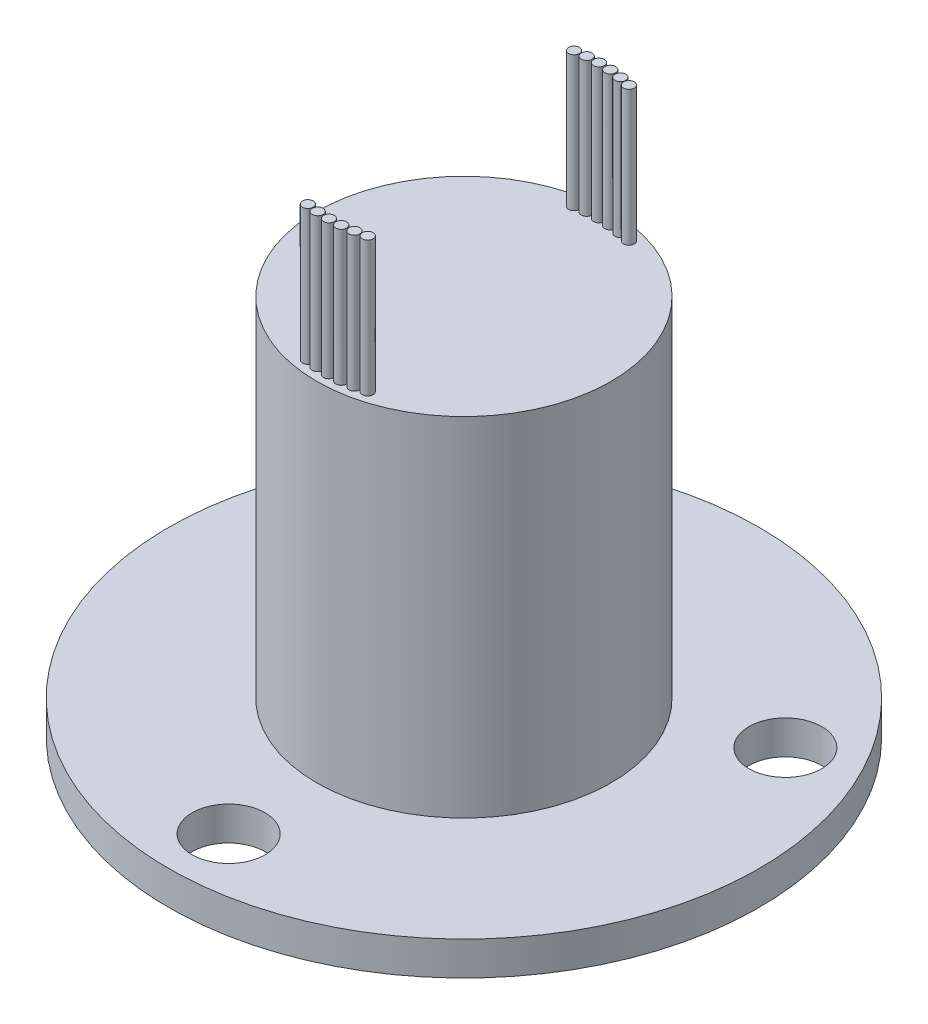
from build123d import *

# Parameters (mm, degrees)
SKETCH_1_W                  = 21.875
SKETCH_1_H                  = 2.5
SKETCH_2_R                  = 10.9
EXTRUDE_1_DEPTH             = 25.75
HOLE_WIZARD_M18_1_D         = 19.2
HOLE_WIZARD_M18_1_DEPTH     = 1.6
SKETCH_5_W                  = 8.1
SKETCH_5_H                  = 1.6
SKETCH_6_W                  = 0.4
SKETCH_6_H                  = 10
SKETCH_7_W                  = 0.4
SKETCH_7_H                  = 10
SKETCH_8_W                  = 0.4
SKETCH_8_H                  = 10
SKETCH_9_W                  = 0.4
SKETCH_9_H                  = 10
SKETCH_10_W                 = 0.4
SKETCH_10_H                 = 10
SKETCH_11_W                 = 0.4
SKETCH_11_H                 = 10
SKETCH_12_W                 = 0.4
SKETCH_12_H                 = 10
SKETCH_13_W                 = 0.4
SKETCH_13_H                 = 10
SKETCH_14_W                 = 0.4
SKETCH_14_H                 = 10
SKETCH_15_W                 = 0.4
SKETCH_15_H                 = 10
SKETCH_16_W                 = 0.4
SKETCH_16_H                 = 10
SKETCH_17_W                 = 0.4
SKETCH_17_H                 = 10
HOLE_WIZARD_5_4_5_4_1_D     = 5.4
HOLE_WIZARD_9_5_9_5_1_D     = 9.5
HOLE_WIZARD_9_5_9_5_1_DEPTH = 0.5


with BuildPart() as part:
    # 草图1 → 旋转1 (revolve)
    with BuildSketch(Plane.XY, mode=Mode.PRIVATE) as revolve_1_sk:
        with Locations((10.9375, 1.25)):
            Rectangle(SKETCH_1_W, SKETCH_1_H)
    revolve(revolve_1_sk.sketch.rotate(Axis((0, 2.5, 0), (0, -1, 0)), 270), axis=Axis((0, 2.5, 0), (0, -1, 0)))

    # 草图2 → 凸台-拉伸1 (add)
    with BuildSketch(Plane(origin=(0, 2.5, 0), x_dir=(-1, 0, 0), z_dir=(0, 1, 0))):
        with Locations(Location((0, 0, 0), (0, 0, 90))):
            Circle(SKETCH_2_R)
    extrude(amount=EXTRUDE_1_DEPTH)

    # M18 间隙孔1
    with Locations(Plane(origin=(0, 0, 0), x_dir=(-1, 0, 0), z_dir=(0, -1, 0))):
        with Locations((0, 0)):
            Hole(HOLE_WIZARD_M18_1_D / 2, depth=HOLE_WIZARD_M18_1_DEPTH)

    # 草图5 → 旋转2 (revolve)
    with BuildSketch(Plane.XY, mode=Mode.PRIVATE) as revolve_2_sk:
        with Locations((4.05, 0.8)):
            Rectangle(SKETCH_5_W, SKETCH_5_H)
    revolve(revolve_2_sk.sketch.rotate(Axis((0, 1.6, 0), (0, -1, 0)), 270), axis=Axis((0, 1.6, 0), (0, -1, 0)))

    # 草图6 → 旋转3 (revolve)
    with BuildSketch(Plane.XY.offset(9.847808943), mode=Mode.PRIVATE) as revolve_3_sk:
        with Locations((1.938004324, 33.25)):
            Rectangle(SKETCH_6_W, SKETCH_6_H)
    revolve(revolve_3_sk.sketch.rotate(Axis((1.738004324, 38.25, 9.847808943), (0, -1, 0)), 270), axis=Axis((1.738004324, 38.25, 9.847808943), (0, -1, 0)))

    # 草图7 → 旋转4 (revolve)
    with BuildSketch(Plane.XY.offset(9.854071628), mode=Mode.PRIVATE) as revolve_4_sk:
        with Locations((-1.502137581, 33.25)):
            Rectangle(SKETCH_7_W, SKETCH_7_H)
    revolve(revolve_4_sk.sketch.rotate(Axis((-1.702137581, 38.25, 9.854071628), (0, -1, 0)), 270), axis=Axis((-1.702137581, 38.25, 9.854071628), (0, -1, 0)))

    # 草图8 → 旋转5 (revolve)
    with BuildSketch(Plane.XY.offset(9.961946981), mode=Mode.PRIVATE) as revolve_5_sk:
        with Locations((-0.671557427, 33.25)):
            Rectangle(SKETCH_8_W, SKETCH_8_H)
    revolve(revolve_5_sk.sketch.rotate(Axis((-0.871557427, 38.25, 9.961946981), (0, -1, 0)), 270), axis=Axis((-0.871557427, 38.25, 9.961946981), (0, -1, 0)))

    # 草图9 → 旋转6 (revolve)
    with BuildSketch(Plane.XY.offset(9.961946981), mode=Mode.PRIVATE) as revolve_6_sk:
        with Locations((1.071557427, 33.25)):
            Rectangle(SKETCH_9_W, SKETCH_9_H)
    revolve(revolve_6_sk.sketch.rotate(Axis((0.871557427, 38.25, 9.961946981), (0, -1, 0)), 270), axis=Axis((0.871557427, 38.25, 9.961946981), (0, -1, 0)))

    # 草图10 → 旋转7 (revolve)
    with BuildSketch(Plane.XY.offset(10), mode=Mode.PRIVATE) as revolve_7_sk:
        with Locations((0.2, 33.25)):
            Rectangle(SKETCH_10_W, SKETCH_10_H)
    revolve(revolve_7_sk.sketch.rotate(Axis((0, 38.25, 10), (0, -1, 0)), 270), axis=Axis((0, 38.25, 10), (0, -1, 0)))

    # 草图11 → 旋转8 (revolve)
    with BuildSketch(Plane.XY.offset(-9.670983902), mode=Mode.PRIVATE) as revolve_8_sk:
        with Locations((2.744026408, 33.25)):
            Rectangle(SKETCH_11_W, SKETCH_11_H)
    revolve(revolve_8_sk.sketch.rotate(Axis((2.544026408, 38.25, -9.670983902), (0, -1, 0)), 270), axis=Axis((2.544026408, 38.25, -9.670983902), (0, -1, 0)))

    # 草图12 → 旋转9 (revolve)
    with BuildSketch(Plane.XY.offset(-9.847808943), mode=Mode.PRIVATE) as revolve_9_sk:
        with Locations((1.938004324, 33.25)):
            Rectangle(SKETCH_12_W, SKETCH_12_H)
    revolve(revolve_9_sk.sketch.rotate(Axis((1.738004324, 38.25, -9.847808943), (0, -1, 0)), 270), axis=Axis((1.738004324, 38.25, -9.847808943), (0, -1, 0)))

    # 草图13 → 旋转10 (revolve)
    with BuildSketch(Plane.XY.offset(-9.854071628), mode=Mode.PRIVATE) as revolve_10_sk:
        with Locations((-1.502137581, 33.25)):
            Rectangle(SKETCH_13_W, SKETCH_13_H)
    revolve(revolve_10_sk.sketch.rotate(Axis((-1.702137581, 38.25, -9.854071628), (0, -1, 0)), 270), axis=Axis((-1.702137581, 38.25, -9.854071628), (0, -1, 0)))

    # 草图14 → 旋转11 (revolve)
    with BuildSketch(Plane.XY.offset(-9.961946981), mode=Mode.PRIVATE) as revolve_11_sk:
        with Locations((-0.671557427, 33.25)):
            Rectangle(SKETCH_14_W, SKETCH_14_H)
    revolve(revolve_11_sk.sketch.rotate(Axis((-0.871557427, 38.25, -9.961946981), (0, -1, 0)), 270), axis=Axis((-0.871557427, 38.25, -9.961946981), (0, -1, 0)))

    # 草图15 → 旋转12 (revolve)
    with BuildSketch(Plane.XY.offset(-9.961946981), mode=Mode.PRIVATE) as revolve_12_sk:
        with Locations((1.071557427, 33.25)):
            Rectangle(SKETCH_15_W, SKETCH_15_H)
    revolve(revolve_12_sk.sketch.rotate(Axis((0.871557427, 38.25, -9.961946981), (0, -1, 0)), 270), axis=Axis((0.871557427, 38.25, -9.961946981), (0, -1, 0)))

    # 草图16 → 旋转13 (revolve)
    with BuildSketch(Plane.XY.offset(-10), mode=Mode.PRIVATE) as revolve_13_sk:
        with Locations((0.2, 33.25)):
            Rectangle(SKETCH_16_W, SKETCH_16_H)
    revolve(revolve_13_sk.sketch.rotate(Axis((0, 38.25, -10), (0, -1, 0)), 270), axis=Axis((0, 38.25, -10), (0, -1, 0)))

    # 草图17 → 旋转14 (revolve)
    with BuildSketch(Plane.XY.offset(9.670983902), mode=Mode.PRIVATE) as revolve_14_sk:
        with Locations((2.744026408, 33.25)):
            Rectangle(SKETCH_17_W, SKETCH_17_H)
    revolve(revolve_14_sk.sketch.rotate(Axis((2.544026408, 38.25, 9.670983902), (0, -1, 0)), 270), axis=Axis((2.544026408, 38.25, 9.670983902), (0, -1, 0)))

    # Ø5.4 (5.4) 直径孔1 (through all)
    with Locations(Plane(origin=(0, 2.5, 0), x_dir=(1, 0, 0), z_dir=(0, 1, 0))):
        with Locations((0, -17.425), (-15.090492661, 8.7125), (15.090492661, 8.7125)):
            Hole(HOLE_WIZARD_5_4_5_4_1_D / 2)

    # Ø9.5 (9.5) 直径孔1
    with Locations(Plane(origin=(0, 0, 0), x_dir=(-1, 0, 0), z_dir=(0, -1, 0))):
        with Locations((0, 0)):
            Hole(HOLE_WIZARD_9_5_9_5_1_D / 2, depth=HOLE_WIZARD_9_5_9_5_1_DEPTH)


solid = part.part
